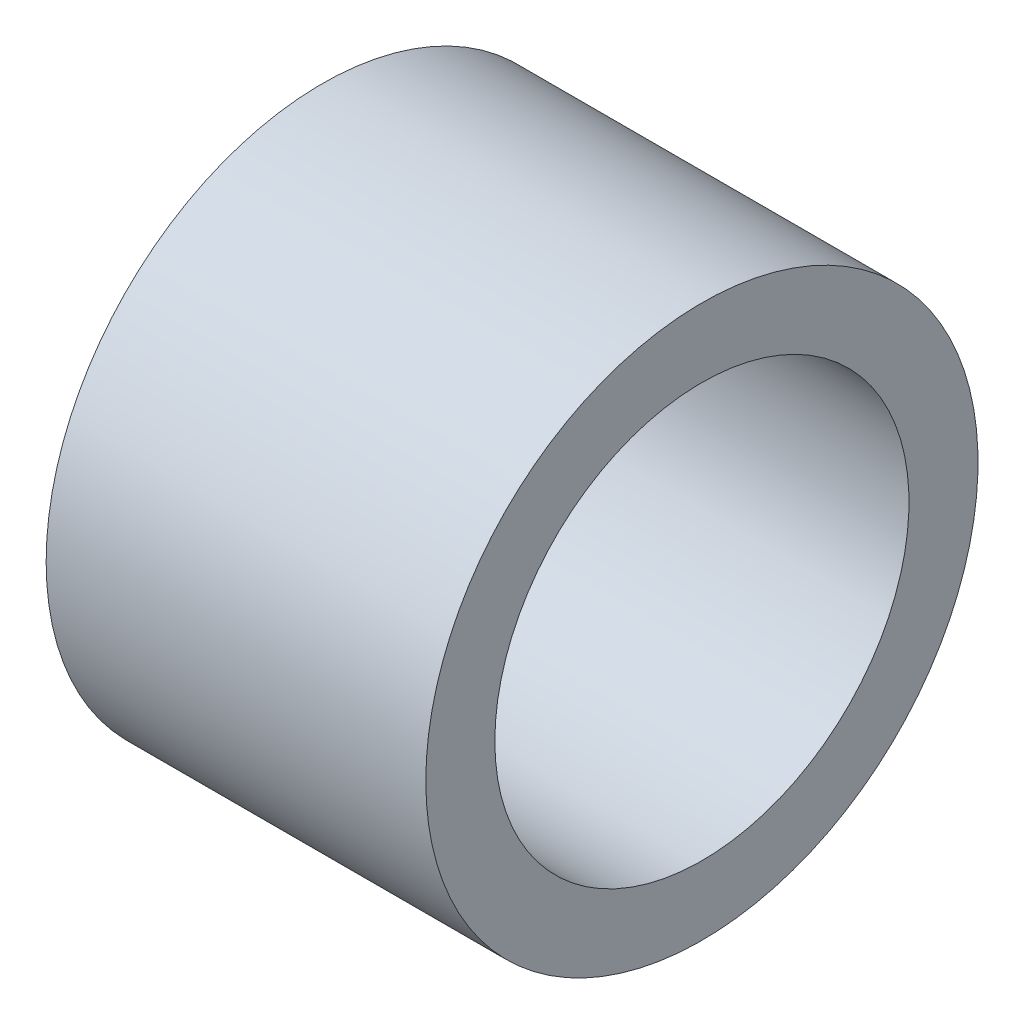
from build123d import *

# Parameters (mm, degrees)
SKETCH1_W = 5.5
SKETCH1_H = 1


with BuildPart() as part:
    # Sketch1 → Revolve1 (revolve)
    with BuildSketch(Plane.XY, mode=Mode.PRIVATE) as revolve1_sk:
        with Locations((2.75, 3.5)):
            Rectangle(SKETCH1_W, SKETCH1_H)
    revolve(revolve1_sk.sketch.rotate(Axis((0, 0, 0), (1, 0, 0)), 90), axis=Axis((0, 0, 0), (1, 0, 0)))


solid = part.part
